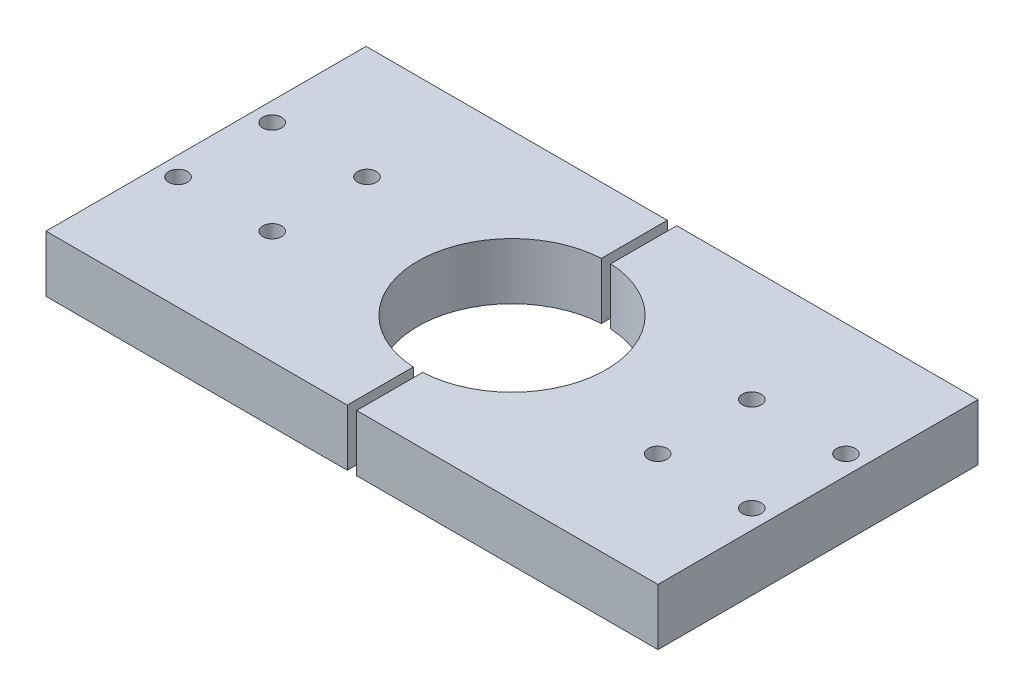
from build123d import *

# Parameters (mm, degrees)
SKETCH1_W             = 64
SKETCH1_H             = 68
BOSS_EXTRUDE1_DEPTH   = 12
BOSS_EXTRUDE1_2_DEPTH = 12
SKETCH2_R             = 20
CUT_EXTRUDE1_DEPTH    = 75.330343737
SKETCH3_R             = 2
CUT_EXTRUDE2_DEPTH    = 75.330343737
SKETCH5_R             = 2
CUT_EXTRUDE3_DEPTH    = 75.330343737
SKETCH6_R             = 3
CUT_EXTRUDE4_DEPTH    = 64
SKETCH7_R             = 5
CUT_EXTRUDE5_DEPTH    = 6
SKETCH8_R             = 2.5
CUT_EXTRUDE6_DEPTH    = 25


with BuildPart() as part:
    # Sketch1 → Boss-Extrude1 (new body)
    with BuildSketch(Plane(origin=(0, 0, 0), x_dir=(1, 0, 0), z_dir=(0, 1, 0))):
        with Locations((33, 0)):
            Rectangle(SKETCH1_W, SKETCH1_H)
    extrude(amount=BOSS_EXTRUDE1_DEPTH)


with BuildPart() as body_2:
    # Sketch1 → Boss-Extrude1 2 (new body)
    with BuildSketch(Plane(origin=(0, 0, 0), x_dir=(1, 0, 0), z_dir=(0, 1, 0))):
        with Locations((-33, 0)):
            Rectangle(SKETCH1_W, SKETCH1_H)
    extrude(amount=BOSS_EXTRUDE1_2_DEPTH)


with BuildPart() as cut_extrude1_tool:
    # Sketch2 → Cut-Extrude1 (new, through all)
    with BuildSketch(Plane(origin=(0, 0, 0), x_dir=(1, 0, 0), z_dir=(0, 1, 0))):
        Circle(SKETCH2_R)
    extrude(amount=CUT_EXTRUDE1_DEPTH)


with BuildPart() as part_1:
    add(part.part)

    # Cut-Extrude1: cut by cut_extrude1_tool
    add(cut_extrude1_tool.part, mode=Mode.SUBTRACT)

    # Sketch5 → Cut-Extrude3 (cut, through all)
    with BuildSketch(Plane(origin=(0, 12, 0), x_dir=(1, 0, 0), z_dir=(0, 1, 0))):
        with Locations(Location((40.95, 10, 0), (0, 0, 270))):
            Circle(SKETCH5_R)
        with Locations(Location((60.95, 10, 0), (0, 0, 270))):
            Circle(SKETCH5_R)
        with Locations(Location((60.95, -10, 0), (0, 0, 270))):
            Circle(SKETCH5_R)
        with Locations(Location((40.95, -10, 0), (0, 0, 270))):
            Circle(SKETCH5_R)
    extrude(amount=-CUT_EXTRUDE3_DEPTH, mode=Mode.SUBTRACT)

    # Sketch8 → Cut-Extrude6 (cut)
    with BuildSketch(Plane.ZY.offset(-1)):
        with Locations((-27, 6)):
            Circle(SKETCH8_R)
        with Locations(Location((27, 6, 0), (0, 0, 180))):
            Circle(SKETCH8_R)
    extrude(amount=-CUT_EXTRUDE6_DEPTH, mode=Mode.SUBTRACT)


with BuildPart() as body_2_1:
    add(body_2.part)

    # Cut-Extrude1: cut by cut_extrude1_tool
    add(cut_extrude1_tool.part, mode=Mode.SUBTRACT)

    # Sketch3 → Cut-Extrude2 (cut, through all)
    with BuildSketch(Plane(origin=(0, 12, 0), x_dir=(1, 0, 0), z_dir=(0, 1, 0))):
        with Locations(Location((-60.95, 10, 0), (0, 0, 270))):
            Circle(SKETCH3_R)
        with Locations(Location((-40.889177155, 10.082916262, 0), (0, 0, 270))):
            Circle(SKETCH3_R)
        with Locations(Location((-40.95, -10, 0), (0, 0, 270))):
            Circle(SKETCH3_R)
        with Locations(Location((-60.95, -10, 0), (0, 0, 270))):
            Circle(SKETCH3_R)
    extrude(amount=-CUT_EXTRUDE2_DEPTH, mode=Mode.SUBTRACT)

    # Sketch6 → Cut-Extrude4 (cut)
    with BuildSketch(Plane.ZY.offset(65)):
        with Locations((-27, 6)):
            Circle(SKETCH6_R)
        with Locations((27, 6)):
            Circle(SKETCH6_R)
    extrude(amount=-CUT_EXTRUDE4_DEPTH, mode=Mode.SUBTRACT)

    # Sketch7 → Cut-Extrude5 (cut)
    with BuildSketch(Plane.ZY.offset(65)):
        with Locations((-27, 6)):
            Circle(SKETCH7_R)
        with Locations((27, 6)):
            Circle(SKETCH7_R)
    extrude(amount=-CUT_EXTRUDE5_DEPTH, mode=Mode.SUBTRACT)


solid = Compound([part_1.part, body_2_1.part])
